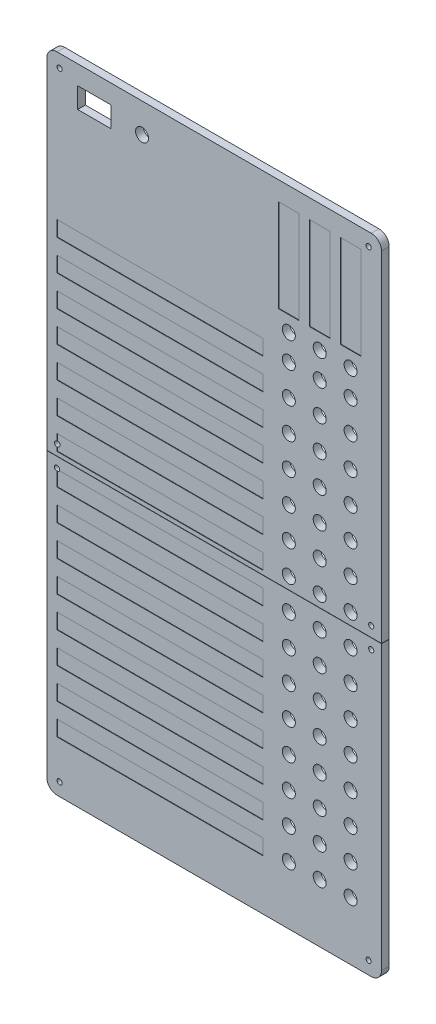
from build123d import *

# Parameters (mm, degrees)
SKIZZE1_W                                   = 130
SKIZZE1_H                                   = 250
AUFSATZ_LINEAR_AUSTRAGEN1_DEPTH             = 3
VERRUNDUNG1_R                               = 4
VERRUNDUNG2_R                               = 4
VERRUNDUNG3_R                               = 4
VERRUNDUNG4_R                               = 4
F_2_0_2_DURCHMESSER_BOHRUNG1_D              = 2
F_2_0_2_DURCHMESSER_BOHRUNG1_DEPTH          = 3
F_2_0_2_DURCHMESSER_BOHRUNG1_TIP            = 0.600860619
SKIZZE6_W                                   = 8
SKIZZE6_H                                   = 36
SCHNITT_LINEAR_AUSTRAGEN1_DEPTH             = 0.2
F_5_05_5_05_DURCHMESSER_BOHRUNG1_D          = 5.05
F_5_05_5_05_DURCHMESSER_BOHRUNG1_DEPTH      = 3
F_5_05_5_05_DURCHMESSER_BOHRUNG1_TIP        = 1.517173063
SCHNITT_LINEAR_AUSTRAGEN_D_NN1_DEPTH        = 282.796025522
SCHNITT_LINEAR_AUSTRAGEN_D_NN1_DEPTH_BACK   = 3
SKIZZE13_W                                  = 130
SKIZZE13_H                                  = 0.1
F_5_05_5_05_DURCHMESSER_BOHRUNG3_AT_2_COUNT = 2
F_5_05_5_05_DURCHMESSER_BOHRUNG3_AT_2_PITCH = 12
F_5_05_5_05_DURCHMESSER_BOHRUNG3_AT_3_COUNT = 2
F_5_05_5_05_DURCHMESSER_BOHRUNG3_AT_3_PITCH = 24
F_2_0_2_DURCHMESSER_BOHRUNG2_AT_2_COUNT     = 2
F_2_0_2_DURCHMESSER_BOHRUNG2_AT_2_PITCH     = 122
F_2_0_2_DURCHMESSER_BOHRUNG2_AT_3_COUNT     = 2
F_2_0_2_DURCHMESSER_BOHRUNG2_AT_3_PITCH     = 122.268597767
F_2_0_2_DURCHMESSER_BOHRUNG2_AT_4_COUNT     = 2
F_2_0_2_DURCHMESSER_BOHRUNG2_AT_4_PITCH     = 8.1
SKIZZE19_W                                  = 80
SKIZZE19_H                                  = 6
SCHNITT_LINEAR_AUSTRAGEN2_DEPTH             = 0.2
SKIZZE20_W                                  = 13
SKIZZE20_H                                  = 8
SCHNITT_LINEAR_AUSTRAGEN3_DEPTH             = 30


with BuildPart() as part:
    # Skizze1 → Aufsatz-Linear austragen1 (new body)
    with BuildSketch(Plane.XY):
        with Locations((65, 125)):
            Rectangle(SKIZZE1_W, SKIZZE1_H)
    extrude(amount=AUFSATZ_LINEAR_AUSTRAGEN1_DEPTH)

    # Verrundung1
    verrundung1_edges = [part.edges().sort_by_distance(p)[0] for p in [
        (130, 0, 1.5),
    ]]
    fillet(verrundung1_edges, radius=VERRUNDUNG1_R)

    # Verrundung2
    verrundung2_edges = [part.edges().sort_by_distance(p)[0] for p in [
        (130, 250, 1.5),
    ]]
    fillet(verrundung2_edges, radius=VERRUNDUNG2_R)

    # Verrundung3
    verrundung3_edges = [part.edges().sort_by_distance(p)[0] for p in [
        (0, 250, 1.5),
    ]]
    fillet(verrundung3_edges, radius=VERRUNDUNG3_R)

    # Verrundung4
    verrundung4_edges = [part.edges().sort_by_distance(p)[0] for p in [
        (0, 0, 1.5),
    ]]
    fillet(verrundung4_edges, radius=VERRUNDUNG4_R)

    # Ø2.0 (2) Durchmesser Bohrung1
    with Locations(Plane.XY.offset(3)):
        with Locations((5, 5), (125, 5), (125, 245), (5, 245)):
            Hole(F_2_0_2_DURCHMESSER_BOHRUNG1_D / 2, depth=F_2_0_2_DURCHMESSER_BOHRUNG1_DEPTH)
            with Locations((0, 0, -(F_2_0_2_DURCHMESSER_BOHRUNG1_DEPTH + F_2_0_2_DURCHMESSER_BOHRUNG1_TIP / 2))):  # 118° drill point
                Cone(0, F_2_0_2_DURCHMESSER_BOHRUNG1_D / 2, F_2_0_2_DURCHMESSER_BOHRUNG1_TIP, mode=Mode.SUBTRACT)

    # Skizze6 → Schnitt-Linear austragen1 (cut)
    with BuildSketch(Plane.XY.offset(3)):
        with Locations((94, 224.618967)):
            Rectangle(SKIZZE6_W, SKIZZE6_H)
        with Locations((106, 224.618967)):
            Rectangle(SKIZZE6_W, SKIZZE6_H)
        with Locations((118, 224.618967)):
            Rectangle(SKIZZE6_W, SKIZZE6_H)
    extrude(amount=-SCHNITT_LINEAR_AUSTRAGEN1_DEPTH, mode=Mode.SUBTRACT)

    # Ø5.05 (5.05) Durchmesser Bohrung1
    with Locations(Plane.XY.offset(3)):
        with Locations((94, 190.618967), (106, 190.618967), (118, 190.618967), (106, 178.618967), (118, 178.618967), (106, 166.618967), (118, 166.618967), (106, 154.618967), (118, 154.618967), (106, 142.618967), (118, 142.618967), (106, 130.618967), (118, 130.618967), (106, 118.618967), (118, 118.618967), (106, 106.618967), (118, 106.618967), (106, 94.618967), (118, 94.618967), (106, 82.618967), (118, 82.618967), (106, 70.618967), (118, 70.618967), (106, 58.618967), (118, 58.618967), (106, 46.618967), (118, 46.618967), (106, 34.618967), (118, 34.618967), (106, 22.618967), (118, 22.618967), (94, 178.618967), (94, 166.618967), (94, 154.618967), (94, 142.618967), (94, 130.618967), (94, 118.618967), (94, 106.618967), (94, 94.618967), (94, 82.618967), (94, 70.618967), (94, 58.618967), (94, 46.618967), (94, 34.618967), (94, 22.618967)):
            Hole(F_5_05_5_05_DURCHMESSER_BOHRUNG1_D / 2, depth=F_5_05_5_05_DURCHMESSER_BOHRUNG1_DEPTH)
            with Locations((0, 0, -(F_5_05_5_05_DURCHMESSER_BOHRUNG1_DEPTH + F_5_05_5_05_DURCHMESSER_BOHRUNG1_TIP / 2))):  # 118° drill point
                Cone(0, F_5_05_5_05_DURCHMESSER_BOHRUNG1_D / 2, F_5_05_5_05_DURCHMESSER_BOHRUNG1_TIP, mode=Mode.SUBTRACT)

    # Skizze13 → Schnitt-Linear-Austragen-Dünn1 (cut, two sides: drawn at the far end of the back side and taken through both)
    with BuildSketch(Plane.XY.offset(3).offset(-SCHNITT_LINEAR_AUSTRAGEN_D_NN1_DEPTH_BACK)):
        with Locations((65, 114)):
            Rectangle(SKIZZE13_W, SKIZZE13_H)
    extrude(amount=SCHNITT_LINEAR_AUSTRAGEN_D_NN1_DEPTH + SCHNITT_LINEAR_AUSTRAGEN_D_NN1_DEPTH_BACK, mode=Mode.SUBTRACT)


with BuildPart() as schnitt_linear_austragen_d_nn1_piece_1:
    # of the separate pieces the step leaves, piece 1, a body of its own (schnitt_linear_austragen_d_nn1_pieces)
    add(part.part.solids().sort_by_distance((4, 250, 0))[0])

    # Skizze15 → Ø5.05 (5.05) Durchmesser Bohrung3 (revolve, cut)
    with BuildSketch(Plane(origin=(94, 200.618967, 3), x_dir=(0, -1, 0), z_dir=(1, 0, 0))):
        Polygon((0, 0), (0, 4.517173063), (2.525, 3), (2.525, 0), align=None)
    f_5_05_5_05_durchmesser_bohrung3 = revolve(axis=Axis((94, 200.618967, 9.35), (0, 0, -1)), mode=Mode.SUBTRACT)

    # Ø5.05 (5.05) Durchmesser Bohrung3 at 2: Ø5.05 (5.05) Durchmesser Bohrung3 ×2
    with Locations(*[(i * F_5_05_5_05_DURCHMESSER_BOHRUNG3_AT_2_PITCH, 0, 0) for i in range(1, F_5_05_5_05_DURCHMESSER_BOHRUNG3_AT_2_COUNT)]):
        add(f_5_05_5_05_durchmesser_bohrung3, mode=Mode.SUBTRACT)

    # Ø5.05 (5.05) Durchmesser Bohrung3 at 3: Ø5.05 (5.05) Durchmesser Bohrung3 ×2
    with Locations(*[(i * F_5_05_5_05_DURCHMESSER_BOHRUNG3_AT_3_PITCH, 0, 0) for i in range(1, F_5_05_5_05_DURCHMESSER_BOHRUNG3_AT_3_COUNT)]):
        add(f_5_05_5_05_durchmesser_bohrung3, mode=Mode.SUBTRACT)

    # Skizze17 → Ø2.0 (2) Durchmesser Bohrung2 (revolve, cut)
    with BuildSketch(Plane(origin=(126, 118.05, 3), x_dir=(0, -1, 0), z_dir=(1, 0, 0))):
        Polygon((0, 0), (0, 3.600860619), (1, 3), (1, 0), align=None)
    f_2_0_2_durchmesser_bohrung2 = revolve(axis=Axis((126, 118.05, 9.35), (0, 0, -1)), mode=Mode.SUBTRACT)

    # Ø2.0 (2) Durchmesser Bohrung2 at 2: Ø2.0 (2) Durchmesser Bohrung2 ×2
    with Locations(*[(-i * F_2_0_2_DURCHMESSER_BOHRUNG2_AT_2_PITCH, 0, 0) for i in range(1, F_2_0_2_DURCHMESSER_BOHRUNG2_AT_2_COUNT)]):
        add(f_2_0_2_durchmesser_bohrung2, mode=Mode.SUBTRACT)


with BuildPart() as schnitt_linear_austragen_d_nn1_piece_2:
    # of the separate pieces the step leaves, piece 2, a body of its own (schnitt_linear_austragen_d_nn1_pieces)
    add(part.part.solids().sort_by_distance((0, 113.95, 0))[0])

    # Ø2.0 (2) Durchmesser Bohrung2 at 3: Ø2.0 (2) Durchmesser Bohrung2 ×2
    with Locations(*[Vector(-0.9978032154430572, -0.06624759053351441, 0) * (i * F_2_0_2_DURCHMESSER_BOHRUNG2_AT_3_PITCH) for i in range(1, F_2_0_2_DURCHMESSER_BOHRUNG2_AT_3_COUNT)]):
        add(f_2_0_2_durchmesser_bohrung2, mode=Mode.SUBTRACT)

    # Ø2.0 (2) Durchmesser Bohrung2 at 4: Ø2.0 (2) Durchmesser Bohrung2 ×2
    with Locations(*[(0, -i * F_2_0_2_DURCHMESSER_BOHRUNG2_AT_4_PITCH, 0) for i in range(1, F_2_0_2_DURCHMESSER_BOHRUNG2_AT_4_COUNT)]):
        add(f_2_0_2_durchmesser_bohrung2, mode=Mode.SUBTRACT)


with BuildPart() as schnitt_linear_austragen2_tool:
    # Skizze19 → Schnitt-Linear austragen2 (new body)
    with BuildSketch(Plane.XY.offset(3)):
        with Locations((43.902000862, 178.618967)):
            Rectangle(SKIZZE19_W, SKIZZE19_H)
        with Locations((43.902000862, 190.618967)):
            Rectangle(SKIZZE19_W, SKIZZE19_H)
        with Locations((43.902000862, 166.618967)):
            Rectangle(SKIZZE19_W, SKIZZE19_H)
        with Locations((43.902000862, 154.618967)):
            Rectangle(SKIZZE19_W, SKIZZE19_H)
        with Locations((43.902000862, 142.618967)):
            Rectangle(SKIZZE19_W, SKIZZE19_H)
        with Locations((43.902000862, 130.618967)):
            Rectangle(SKIZZE19_W, SKIZZE19_H)
        with Locations((43.902000862, 118.618967)):
            Rectangle(SKIZZE19_W, SKIZZE19_H)
        with Locations((43.902000862, 106.618967)):
            Rectangle(SKIZZE19_W, SKIZZE19_H)
        with Locations((43.902000862, 94.618967)):
            Rectangle(SKIZZE19_W, SKIZZE19_H)
        with Locations((43.902000862, 82.618967)):
            Rectangle(SKIZZE19_W, SKIZZE19_H)
        with Locations((43.902000862, 70.618967)):
            Rectangle(SKIZZE19_W, SKIZZE19_H)
        with Locations((43.902000862, 58.618967)):
            Rectangle(SKIZZE19_W, SKIZZE19_H)
        with Locations((43.902000862, 46.618967)):
            Rectangle(SKIZZE19_W, SKIZZE19_H)
        with Locations((43.902000862, 34.618967)):
            Rectangle(SKIZZE19_W, SKIZZE19_H)
        with Locations((43.902000862, 22.618967)):
            Rectangle(SKIZZE19_W, SKIZZE19_H)
    extrude(amount=-SCHNITT_LINEAR_AUSTRAGEN2_DEPTH)


with BuildPart() as schnitt_linear_austragen_d_nn1_piece_1_1:
    add(schnitt_linear_austragen_d_nn1_piece_1.part)

    # Schnitt-Linear austragen2: cut by schnitt_linear_austragen2_tool
    add(schnitt_linear_austragen2_tool.part, mode=Mode.SUBTRACT)

    # Skizze20 → Schnitt-Linear austragen3 (cut)
    with BuildSketch(Plane.XY.offset(3)):
        with Locations((18.5, 238.618967)):
            Rectangle(SKIZZE20_W, SKIZZE20_H)
    extrude(amount=-SCHNITT_LINEAR_AUSTRAGEN3_DEPTH, mode=Mode.SUBTRACT)

    # Skizze22 → Ø5.05 (5.05) Durchmesser Bohrung4 (revolve, cut)
    with BuildSketch(Plane(origin=(37, 238.618967, 3), x_dir=(0, -1, 0), z_dir=(1, 0, 0))):
        Polygon((0, 0), (0, 4.517173063), (2.525, 3), (2.525, 0), align=None)
    revolve(axis=Axis((37, 238.618967, 9.35), (0, 0, -1)), mode=Mode.SUBTRACT)


with BuildPart() as schnitt_linear_austragen_d_nn1_piece_2_1:
    add(schnitt_linear_austragen_d_nn1_piece_2.part)

    # Schnitt-Linear austragen2: cut by schnitt_linear_austragen2_tool
    add(schnitt_linear_austragen2_tool.part, mode=Mode.SUBTRACT)


solid = Compound([schnitt_linear_austragen_d_nn1_piece_1_1.part, schnitt_linear_austragen_d_nn1_piece_2_1.part])
